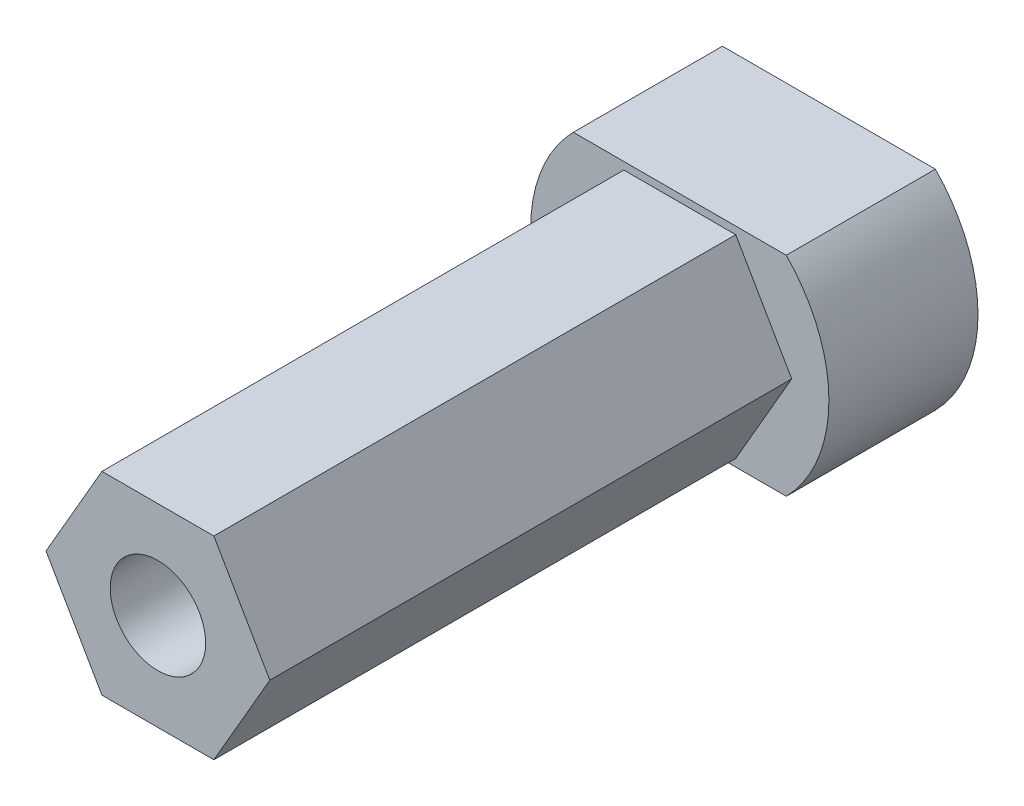
from build123d import *

# Parameters (mm, degrees)
EXTRUDE_1_DEPTH     = 5
EXTRUDE_2_DEPTH     = 17.5
SKETCH_3_R          = 1.6
CUT_EXTRUDE_1_DEPTH = 24.313086454
CUT_EXTRUDE_START   = -8
CUT_EXTRUDE_2_DEPTH = 8


with BuildPart() as part:
    # 草图1 → 凸台-拉伸1 (new body)
    with BuildSketch(Plane.XY):
        with BuildLine():
            ThreePointArc((-3.570714214, 3.5), (-4.628907596, 1.890294809), (-5, 0))
            Line((-5, 0), (5, 0))
            ThreePointArc((5, 0), (4.628907596, 1.890294809), (3.570714214, 3.5))
            Line((3.570714214, 3.5), (-3.570714214, 3.5))
        make_face()
        with BuildLine():
            Line((5, 0), (-5, 0))
            ThreePointArc((-5, 0), (-4.628907596, -1.890294809), (-3.570714214, -3.5))
            Line((-3.570714214, -3.5), (3.570714214, -3.5))
            ThreePointArc((3.570714214, -3.5), (4.628907596, -1.890294809), (5, 0))
        make_face()
    extrude(amount=EXTRUDE_1_DEPTH)

    # 草图2 → 凸台-拉伸2 (add)
    with BuildSketch(Plane.XY.offset(5)):
        Polygon((1.876388375, 3.25), (-1.876388375, 3.25), (-3.75277675, 0), (-1.876388375, -3.25), (1.876388375, -3.25), (3.75277675, 0), align=None)
    extrude(amount=EXTRUDE_2_DEPTH)

    # 草图3 → 切除-拉伸1 (cut, through all)
    with BuildSketch(Plane.XY.offset(22.5)):
        Circle(SKETCH_3_R)
    extrude(amount=-CUT_EXTRUDE_1_DEPTH, mode=Mode.SUBTRACT)

    # 草图4 → 切除-拉伸2 (cut)
    with BuildSketch(Plane(origin=(0, 0, 0), x_dir=(-1, 0, 0), z_dir=(0, 0, -1)).offset(CUT_EXTRUDE_START)):
        with BuildLine():
            Line((2.011684617, 1.875), (-2.011684617, 1.875))
            ThreePointArc((-2.011684617, 1.875), (-2.55877243, 1.007563224), (-2.75, 0))
            Line((-2.75, 0), (-1.6, 0))
            ThreePointArc((-1.6, 0), (0, 1.6), (1.6, 0))
            Line((1.6, 0), (2.75, 0))
            ThreePointArc((2.75, 0), (2.55877243, 1.007563224), (2.011684617, 1.875))
        make_face()
        with BuildLine():
            Line((-1.6, 0), (-2.75, 0))
            ThreePointArc((-2.75, 0), (-2.55877243, -1.007563224), (-2.011684617, -1.875))
            Line((-2.011684617, -1.875), (2.011684617, -1.875))
            ThreePointArc((2.011684617, -1.875), (2.55877243, -1.007563224), (2.75, 0))
            Line((2.75, 0), (1.6, 0))
            ThreePointArc((1.6, 0), (0, -1.6), (-1.6, 0))
        make_face()
    extrude(amount=CUT_EXTRUDE_2_DEPTH, mode=Mode.SUBTRACT)


solid = part.part
